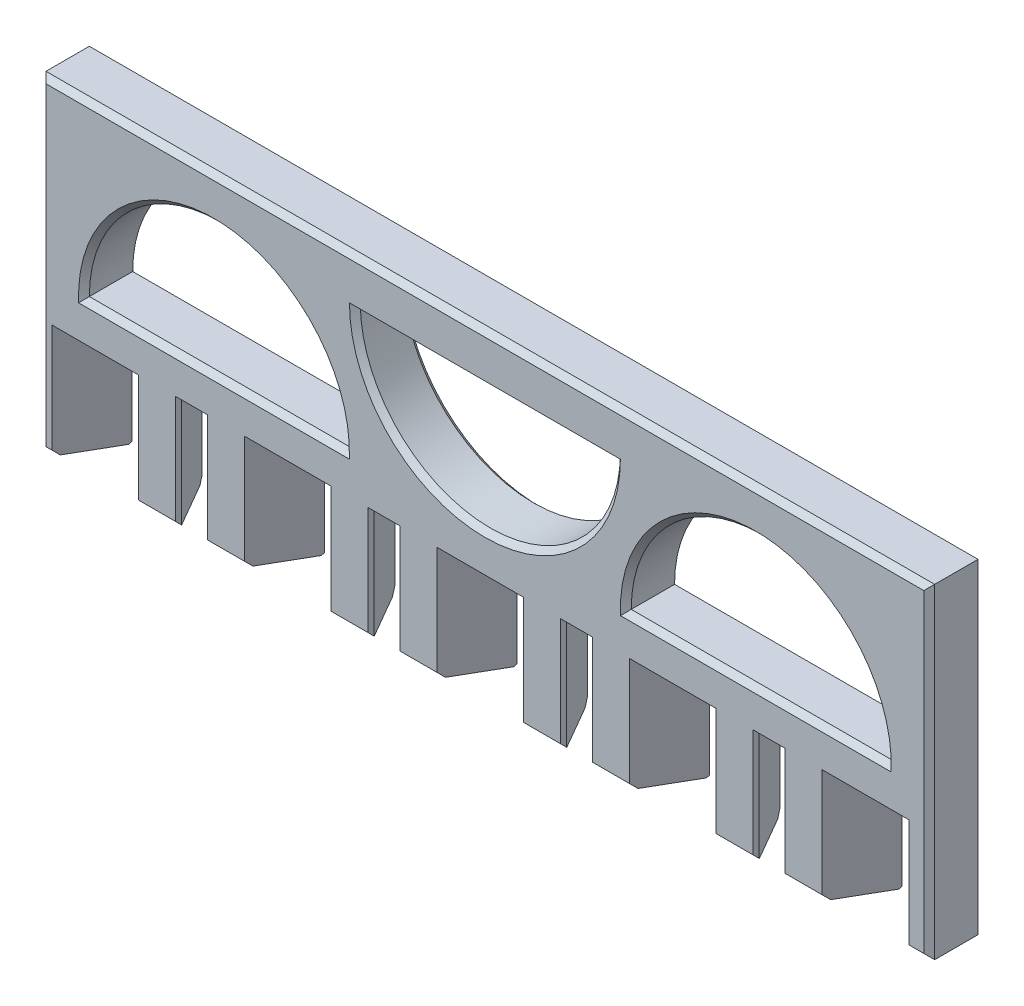
from build123d import *
from OCP.BRepFilletAPI import BRepFilletAPI_MakeChamfer

# Parameters (mm, degrees)
SKETCH1_W           = 82
SKETCH1_H           = 30
BOSS_EXTRUDE1_DEPTH = 5
CUT_EXTRUDE1_DEPTH  = 10
CHAMFER1_SIZE       = 0.5
CHAMFER1_SIZE2      = 0.366025404
CUT_EXTRUDE3_REACH  = 89.459
CHAMFER3_SIZE       = 0.5


with BuildPart() as part:
    # Sketch1 → Boss-Extrude1 (new body)
    with BuildSketch(Plane.XY):
        with Locations((41, 15)):
            Rectangle(SKETCH1_W, SKETCH1_H)
    extrude(amount=BOSS_EXTRUDE1_DEPTH)

    # Sketch2 → Cut-Extrude1 (cut)
    with BuildSketch(Plane.XZ):
        Polygon((0.973292227, 5.1), (9.093205081, 5.1), (6.090983681, -0.1), (3.975513627, -0.1), align=None)
        Polygon((9.860043573, -0.1), (17.979956427, -0.1), (14.977735027, 5.1), (12.862264973, 5.1), align=None)
        Polygon((18.743292227, 5.1), (26.863205081, 5.1), (23.860983681, -0.1), (21.745513627, -0.1), align=None)
        Polygon((27.630043573, -0.1), (35.749956427, -0.1), (32.747735027, 5.1), (30.632264973, 5.1), align=None)
        Polygon((36.513292227, 5.1), (44.633205081, 5.1), (41.630983681, -0.1), (39.515513627, -0.1), align=None)
        Polygon((45.400043573, -0.1), (53.519956427, -0.1), (50.517735027, 5.1), (48.402264973, 5.1), align=None)
        Polygon((54.283292227, 5.1), (62.403205081, 5.1), (59.400983681, -0.1), (57.285513627, -0.1), align=None)
        Polygon((63.170043573, -0.1), (71.289956427, -0.1), (68.287735027, 5.1), (66.172264973, 5.1), align=None)
        Polygon((72.053292227, 5.1), (80.173205081, 5.1), (77.170983681, -0.1), (75.055513627, -0.1), align=None)
    extrude(amount=-CUT_EXTRUDE1_DEPTH, mode=Mode.SUBTRACT)

    # Chamfer1: one chamfer whose edges measure the first distance from different faces: ONE call of the kernel's chamfer builder (chamfer() names one face for all edges)
    chamfer1_edges_1 = [part.edges().sort_by_distance(p)[0] for p in [
        (31.69, 10, 5),
        (40.573248654, 10, 5),
        (49.46, 10, 5),
        (58.343248654, 10, 5),
        (8.033248654, 0, 0),
        (67.23, 10, 5),
        (19.805, 0, 0),
        (25.803248654, 0, 0),
        (37.575, 0, 0),
        (76.113248654, 10, 5),
        (43.573248654, 0, 0),
        (55.345, 0, 0),
        (61.343248654, 0, 0),
        (73.115, 0, 0),
        (79.614359354, 0, 0),
        (76.113248654, 10, 0),
        (67.23, 10, 0),
        (58.343248654, 10, 0),
        (49.46, 10, 0),
        (40.573248654, 10, 0),
        (31.69, 10, 0),
        (22.803248654, 10, 0),
        (13.92, 10, 0),
        (5.033248654, 10, 0),
        (10.92, 0, 5),
        (16.918248654, 0, 5),
        (28.69, 0, 5),
        (34.688248654, 0, 5),
        (46.46, 0, 5),
        (52.458248654, 0, 5),
        (64.23, 0, 5),
        (70.228248654, 0, 5),
        (81.057735027, 0, 5),
        (1.9588893, 0, 0),
        (5.033248654, 10, 5),
        (13.92, 10, 5),
        (0.515513627, 0, 5),
        (22.803248654, 10, 5),
    ]]
    chamfer1_edges_2 = [part.edges().sort_by_distance(p)[0] for p in [
        (48.344529946, 5, 5),
    ]]
    chamfer1_side_2 = [part.faces().sort_by_distance(p)[0] for p in [
        (46.901154273, 5, 2.5),
    ]]
    chamfer1_edges_3 = [part.edges().sort_by_distance(p)[0] for p in [
        (50.575470054, 5, 5),
    ]]
    chamfer1_side_3 = [part.faces().sort_by_distance(p)[0] for p in [
        (52.018845727, 5, 2.5),
    ]]
    chamfer1_edges_4 = [part.edges().sort_by_distance(p)[0] for p in [
        (66.114529946, 5, 5),
    ]]
    chamfer1_side_4 = [part.faces().sort_by_distance(p)[0] for p in [
        (64.671154273, 5, 2.5),
    ]]
    chamfer1_edges_5 = [part.edges().sort_by_distance(p)[0] for p in [
        (68.345470054, 5, 5),
    ]]
    chamfer1_side_5 = [part.faces().sort_by_distance(p)[0] for p in [
        (69.788845727, 5, 2.5),
    ]]
    chamfer1_edges_6 = [part.edges().sort_by_distance(p)[0] for p in [
        (77.228718708, 5, 0),
        (74.9977786, 5, 0),
        (59.458718708, 5, 0),
        (57.2277786, 5, 0),
        (41.688718708, 5, 0),
        (39.4577786, 5, 0),
        (23.918718708, 5, 0),
        (21.6877786, 5, 0),
        (6.148718708, 5, 0),
        (3.9177786, 5, 0),
    ]]
    chamfer1_side_6 = [part.faces().sort_by_distance(p)[0] for p in [
        (41.090558892, 17.128531177, 0),
    ]]
    chamfer1_edges_7 = [part.edges().sort_by_distance(p)[0] for p in [
        (12.804529946, 5, 5),
    ]]
    chamfer1_side_7 = [part.faces().sort_by_distance(p)[0] for p in [
        (11.361154273, 5, 2.5),
    ]]
    chamfer1_edges_8 = [part.edges().sort_by_distance(p)[0] for p in [
        (15.035470054, 5, 5),
    ]]
    chamfer1_side_8 = [part.faces().sort_by_distance(p)[0] for p in [
        (16.478845727, 5, 2.5),
    ]]
    chamfer1_edges_9 = [part.edges().sort_by_distance(p)[0] for p in [
        (30.574529946, 5, 5),
    ]]
    chamfer1_side_9 = [part.faces().sort_by_distance(p)[0] for p in [
        (29.131154273, 5, 2.5),
    ]]
    chamfer1_edges_10 = [part.edges().sort_by_distance(p)[0] for p in [
        (32.805470054, 5, 5),
    ]]
    chamfer1_side_10 = [part.faces().sort_by_distance(p)[0] for p in [
        (34.248845727, 5, 2.5),
    ]]
    chamfer1 = BRepFilletAPI_MakeChamfer(part.part.solid().wrapped)
    for e in chamfer1_edges_1:
        chamfer1.Add(CHAMFER1_SIZE, e.wrapped)
    for e in chamfer1_edges_2:
        chamfer1.Add(CHAMFER1_SIZE, CHAMFER1_SIZE2, e.wrapped, chamfer1_side_2[0].wrapped)  # the first distance lies on this face
    for e in chamfer1_edges_3:
        chamfer1.Add(CHAMFER1_SIZE, CHAMFER1_SIZE2, e.wrapped, chamfer1_side_3[0].wrapped)  # the first distance lies on this face
    for e in chamfer1_edges_4:
        chamfer1.Add(CHAMFER1_SIZE, CHAMFER1_SIZE2, e.wrapped, chamfer1_side_4[0].wrapped)  # the first distance lies on this face
    for e in chamfer1_edges_5:
        chamfer1.Add(CHAMFER1_SIZE, CHAMFER1_SIZE2, e.wrapped, chamfer1_side_5[0].wrapped)  # the first distance lies on this face
    for e in chamfer1_edges_6:
        chamfer1.Add(CHAMFER1_SIZE, CHAMFER1_SIZE2, e.wrapped, chamfer1_side_6[0].wrapped)  # the first distance lies on this face
    for e in chamfer1_edges_7:
        chamfer1.Add(CHAMFER1_SIZE, CHAMFER1_SIZE2, e.wrapped, chamfer1_side_7[0].wrapped)  # the first distance lies on this face
    for e in chamfer1_edges_8:
        chamfer1.Add(CHAMFER1_SIZE, CHAMFER1_SIZE2, e.wrapped, chamfer1_side_8[0].wrapped)  # the first distance lies on this face
    for e in chamfer1_edges_9:
        chamfer1.Add(CHAMFER1_SIZE, CHAMFER1_SIZE2, e.wrapped, chamfer1_side_9[0].wrapped)  # the first distance lies on this face
    for e in chamfer1_edges_10:
        chamfer1.Add(CHAMFER1_SIZE, CHAMFER1_SIZE2, e.wrapped, chamfer1_side_10[0].wrapped)  # the first distance lies on this face
    add(Compound.cast(chamfer1.Shape()), mode=Mode.REPLACE)

    # Sketch11 → Cut-Extrude3 (cut, up to next)
    with BuildSketch(Plane.XY.offset(5), mode=Mode.PRIVATE) as cut_extrude3_sk1:
        with BuildLine():
            Line((4, 14), (28, 14))
            ThreePointArc((28, 14), (16, 26), (4, 14))
        make_face()
    cut_extrude3_tool1 = extrude(cut_extrude3_sk1.sketch, amount=-CUT_EXTRUDE3_REACH, mode=Mode.PRIVATE) & part.part
    # Sketch11 → Cut-Extrude3 (cut, up to next)
    with BuildSketch(Plane.XY.offset(5), mode=Mode.PRIVATE) as cut_extrude3_sk2:
        with BuildLine():
            Line((29, 26), (53, 26))
            ThreePointArc((53, 26), (41, 14), (29, 26))
        make_face()
    cut_extrude3_tool2 = extrude(cut_extrude3_sk2.sketch, amount=-CUT_EXTRUDE3_REACH, mode=Mode.PRIVATE) & part.part
    # Sketch11 → Cut-Extrude3 (cut, up to next)
    with BuildSketch(Plane.XY.offset(5), mode=Mode.PRIVATE) as cut_extrude3_sk3:
        with BuildLine():
            Line((54, 14), (78, 14))
            ThreePointArc((78, 14), (66, 26), (54, 14))
        make_face()
    cut_extrude3_tool3 = extrude(cut_extrude3_sk3.sketch, amount=-CUT_EXTRUDE3_REACH, mode=Mode.PRIVATE) & part.part
    add(cut_extrude3_tool1.solids().sort_by_distance((16, 19.092958, 5))[0], mode=Mode.SUBTRACT)
    add(cut_extrude3_tool2.solids().sort_by_distance((41, 20.907042, 5))[0], mode=Mode.SUBTRACT)
    add(cut_extrude3_tool3.solids().sort_by_distance((66, 19.092958, 5))[0], mode=Mode.SUBTRACT)

    # Chamfer3
    chamfer3_edges = [part.edges().sort_by_distance(p)[0] for p in [
        (82, 15.25, 0),
        (0, 15.25, 0),
        (41, 30, 0),
        (0, 15.25, 5),
        (41, 30, 5),
        (41, 14, 5),
        (66, 14, 0),
        (66, 26, 0),
        (66, 14, 5),
        (66, 26, 5),
        (41, 14, 0),
        (41, 26, 0),
        (16, 14, 0),
        (16, 26, 0),
        (16, 14, 5),
        (16, 26, 5),
        (82, 15.25, 5),
    ]]
    chamfer(chamfer3_edges, length=CHAMFER3_SIZE)


solid = part.part
